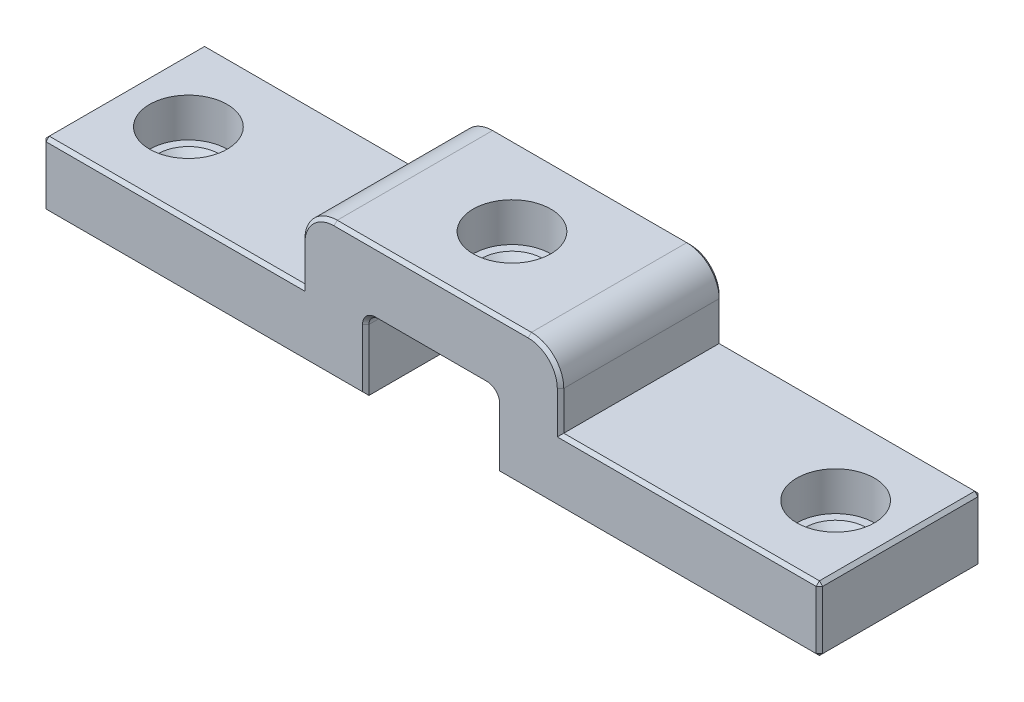
from build123d import *

# Parameters (mm, degrees)
SKETCH1_W               = 120
SKETCH1_H               = 25
BOSS_EXTRUDE1_DEPTH     = 10
SKETCH2_W               = 40
SKETCH2_H               = 25
BOSS_EXTRUDE2_DEPTH     = 11
SKETCH3_W               = 20.2
SKETCH3_H               = 25
CUT_EXTRUDE1_DEPTH      = 11
CUT_EXTRUDE2_DEPTH      = 63.267567802
CUT_EXTRUDE2_DEPTH_BACK = 63.267567802
SKETCH4_R               = 2.75
FILLET1_R               = 5
FILLET2_R               = 1.5
CHAMFER1_SIZE           = 0.5
SKETCH5_R               = 6
CUT_EXTRUDE3_DEPTH      = 6
CHAMFER2_SIZE           = 2
SKETCH6_R               = 6
CUT_EXTRUDE4_DEPTH      = 6
CHAMFER3_SIZE           = 2


with BuildPart() as part:
    # Sketch1 → Boss-Extrude1 (new body)
    with BuildSketch(Plane(origin=(0, 0, 0), x_dir=(1, 0, 0), z_dir=(0, 1, 0))):
        Rectangle(SKETCH1_W, SKETCH1_H)
    extrude(amount=BOSS_EXTRUDE1_DEPTH)

    # Sketch2 → Boss-Extrude2 (add)
    with BuildSketch(Plane(origin=(0, 10, 0), x_dir=(1, 0, 0), z_dir=(0, 1, 0))):
        Rectangle(SKETCH2_W, SKETCH2_H)
    extrude(amount=BOSS_EXTRUDE2_DEPTH)

    # Sketch3 → Cut-Extrude1 (cut)
    with BuildSketch(Plane(origin=(0, 0, 0), x_dir=(1, 0, 0), z_dir=(0, 1, 0))):
        Rectangle(SKETCH3_W, SKETCH3_H)
    extrude(amount=CUT_EXTRUDE1_DEPTH, mode=Mode.SUBTRACT)

    # Sketch4 → Cut-Extrude2 (cut, two sides: drawn at the far end of the back side and taken through both)
    with BuildSketch(Plane.XZ.offset(-11).offset(-CUT_EXTRUDE2_DEPTH_BACK)):
        with Locations(Location((0, 0, 0), (0, 0, 270))):
            Circle(SKETCH4_R)
        with Locations(Location((-50, 0, 0), (0, 0, 270))):
            Circle(SKETCH4_R)
        with Locations(Location((50, 0, 0), (0, 0, 270))):
            Circle(SKETCH4_R)
    extrude(amount=CUT_EXTRUDE2_DEPTH + CUT_EXTRUDE2_DEPTH_BACK, mode=Mode.SUBTRACT)

    # Fillet1
    fillet1_edges = [part.edges().sort_by_distance(p)[0] for p in [
        (-20, 21, 0),
        (20, 21, 0),
    ]]
    fillet(fillet1_edges, radius=FILLET1_R)

    # Fillet2
    fillet2_edges = [part.edges().sort_by_distance(p)[0] for p in [
        (-10.1, 11, 0),
        (10.1, 11, 0),
    ]]
    fillet(fillet2_edges, radius=FILLET2_R)

    # Chamfer1
    chamfer1_edges = [part.edges().sort_by_distance(p)[0] for p in [
        (60, 10, 0),
        (40, 10, 12.5),
        (-40, 10, -12.5),
        (40, 10, -12.5),
        (-35.05, 0, -12.5),
        (35.05, 0, 12.5),
        (-60, 10, 0),
        (35.05, 0, -12.5),
        (60, 0, 0),
        (-35.05, 0, 12.5),
        (0, 21, 12.5),
        (0, 21, -12.5),
        (20, 13, 12.5),
        (-20, 13, 12.5),
        (18.535533906, 19.535533906, 12.5),
        (-60, 0, 0),
        (-18.535533906, 19.535533906, 12.5),
        (-20, 13, -12.5),
        (20, 13, -12.5),
        (18.535533906, 19.535533906, -12.5),
        (-18.535533906, 19.535533906, -12.5),
        (10.1, 4.75, 12.5),
        (10.1, 4.75, -12.5),
        (0, 11, -12.5),
        (0, 11, 12.5),
        (-10.1, 4.75, -12.5),
        (-10.1, 4.75, 12.5),
        (9.660660172, 10.560660172, -12.5),
        (9.660660172, 10.560660172, 12.5),
        (-9.660660172, 10.560660172, 12.5),
        (-9.660660172, 10.560660172, -12.5),
        (-60, 5, -12.5),
        (60, 5, -12.5),
        (60, 5, 12.5),
        (-60, 5, 12.5),
        (-40, 10, 12.5),
    ]]
    chamfer(chamfer1_edges, length=CHAMFER1_SIZE)

    # Sketch5 → Cut-Extrude3 (cut)
    with BuildSketch(Plane(origin=(0, 10, 0), x_dir=(1, 0, 0), z_dir=(0, 1, 0))):
        with Locations(Location((-50, 0, 0), (0, 0, 270))):
            Circle(SKETCH5_R)
        with Locations(Location((50, 0, 0), (0, 0, 270))):
            Circle(SKETCH5_R)
    extrude(amount=-CUT_EXTRUDE3_DEPTH, mode=Mode.SUBTRACT)

    # Chamfer2
    chamfer2_edges = [part.edges().sort_by_distance(p)[0] for p in [
        (-50, 4, 2.75),
        (50, 4, 2.75),
    ]]
    chamfer(chamfer2_edges, length=CHAMFER2_SIZE)

    # Sketch6 → Cut-Extrude4 (cut)
    with BuildSketch(Plane(origin=(0, 21, 0), x_dir=(1, 0, 0), z_dir=(0, 1, 0))):
        with Locations(Location((0, 0, 0), (0, 0, 270))):
            Circle(SKETCH6_R)
    extrude(amount=-CUT_EXTRUDE4_DEPTH, mode=Mode.SUBTRACT)

    # Chamfer3
    chamfer3_edges = [part.edges().sort_by_distance(p)[0] for p in [
        (0, 15, 2.75),
    ]]
    chamfer(chamfer3_edges, length=CHAMFER3_SIZE)


solid = part.part
